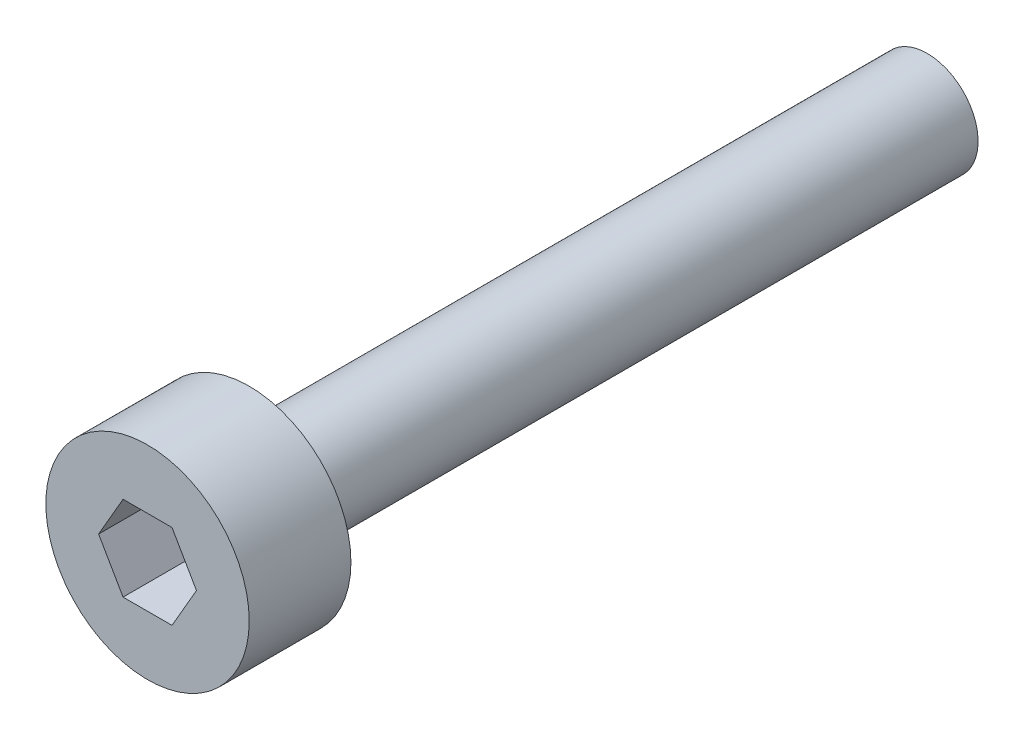
from build123d import *

# Parameters (mm, degrees)
SKETCH_5_R          = 3
EXTRUDE_1_DEPTH     = 3
CUT_EXTRUDE_1_DEPTH = 2
SKETCH_7_R          = 1.5
EXTRUDE_2_DEPTH     = 20


with BuildPart() as part:
    # ｽｹｯﾁ5 → ﾎﾞｽ - 押し出し1 (new body)
    with BuildSketch(Plane.XY):
        Circle(SKETCH_5_R)
    extrude(amount=EXTRUDE_1_DEPTH)

    # ｽｹｯﾁ6 → ｶｯﾄ - 押し出し1 (cut)
    with BuildSketch(Plane.XY.offset(3)):
        Polygon((1.443375673, 0), (0.721687836, 1.25), (-0.721687836, 1.25), (-1.443375673, 0), (-0.721687836, -1.25), (0.721687836, -1.25), align=None)
    extrude(amount=-CUT_EXTRUDE_1_DEPTH, mode=Mode.SUBTRACT)

    # ｽｹｯﾁ7 → ﾎﾞｽ - 押し出し2 (add)
    with BuildSketch(Plane(origin=(0, 0, 0), x_dir=(-1, 0, 0), z_dir=(0, 0, -1))):
        Circle(SKETCH_7_R)
    extrude(amount=EXTRUDE_2_DEPTH)


solid = part.part
